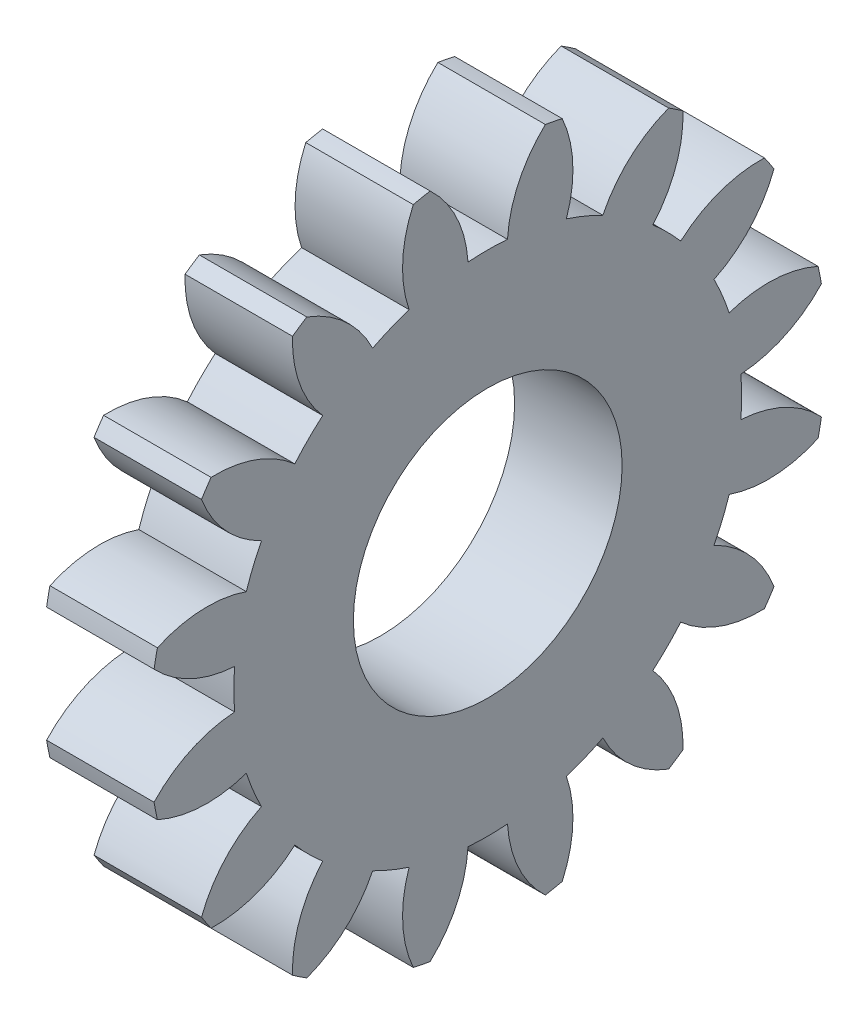
from build123d import *

# Parameters (mm, degrees)
BASPROSKE_W     = 2
BASPROSKE_H     = 6.3
TOOTHCUT_DEPTH  = 10.131264973
TEETHCUTS_COUNT = 16
TEETHCUTS_ANGLE = 337.5
BORSKE_R        = 2.5
BORE_DEPTH      = 50.0000508


with BuildPart() as part:
    # BasProSke → Base-Revolve (revolve)
    with BuildSketch(Plane(origin=(0, 0, 0), x_dir=(1, 0, 0), z_dir=(0, 1, 0)), mode=Mode.PRIVATE) as base_revolve_sk:
        with Locations((1, 3.15)):
            Rectangle(BASPROSKE_W, BASPROSKE_H)
    revolve(base_revolve_sk.sketch.rotate(Axis((-10, 0, 0), (1, 0, 0)), 180), axis=Axis((-10, 0, 0), (1, 0, 0)))

    # TooCutSke → ToothCut (cut, through all)
    with BuildSketch(Plane(origin=(0, 0, 0), x_dir=(0, 0, -1), z_dir=(1, 0, 0))):
        with BuildLine():
            ThreePointArc((0.367227906, 4.709704838), (0, 4.724), (-0.367227906, 4.709704838))
            ThreePointArc((-0.367227906, 4.709704838), (-0.582796539, 5.540866808), (-1.09523038, 6.229859996))
            ThreePointArc((-1.09523038, 6.229859996), (0, 6.3254), (1.09523038, 6.229859996))
            ThreePointArc((1.09523038, 6.229859996), (0.582796539, 5.540866808), (0.367227906, 4.709704838))
        make_face()
    toothcut = extrude(amount=TOOTHCUT_DEPTH, mode=Mode.SUBTRACT)

    # TeethCuts: ToothCut ×16 about axis
    teethcuts_axis = Axis((-10, 0, 0), (1, 0, 0))
    for i in range(1, TEETHCUTS_COUNT):
        add(toothcut.rotate(teethcuts_axis, i * TEETHCUTS_ANGLE / (TEETHCUTS_COUNT - 1)), mode=Mode.SUBTRACT)

    # BorSke → Bore (cut, symmetric)
    with BuildSketch(Plane(origin=(0, 0, 0), x_dir=(0, 0, -1), z_dir=(1, 0, 0))):
        with Locations(Location((0, 0, 0), (0, 0, 180))):
            Circle(BORSKE_R)
    extrude(amount=BORE_DEPTH, both=True, mode=Mode.SUBTRACT)


solid = part.part
